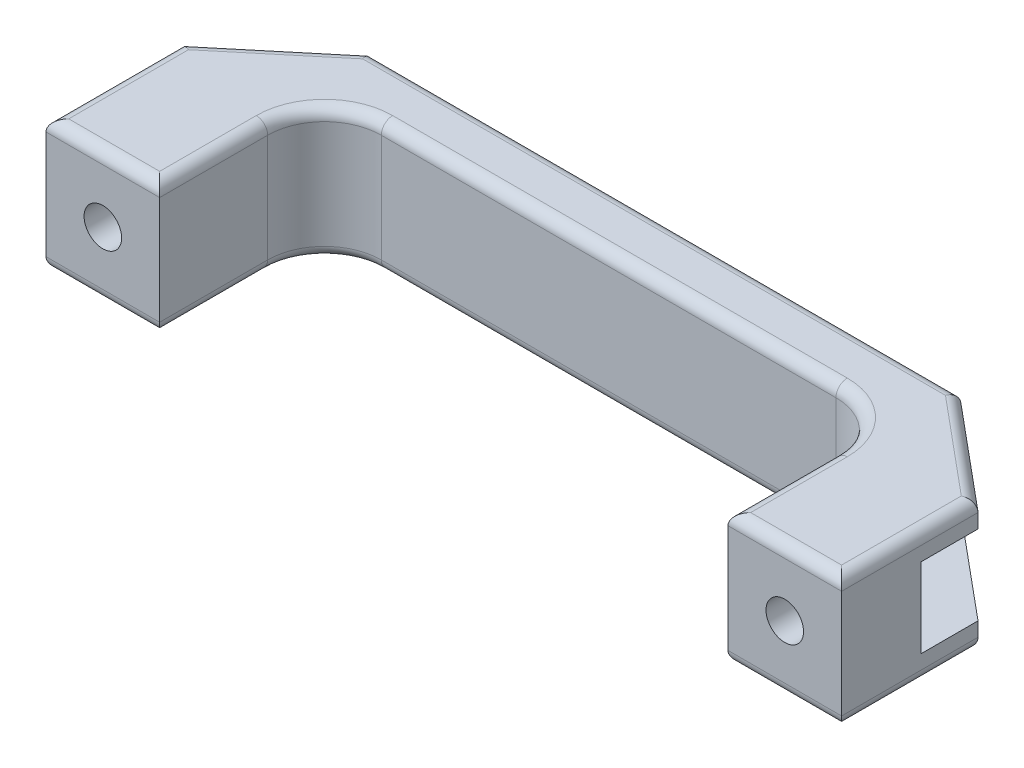
from build123d import *

# Parameters (mm, degrees)
EXTRUDE_1_DEPTH              = 23
CUT_EXTRUDE_1_DEPTH          = 84.366660003
CUT_EXTRUDE_1_DEPTH_BACK     = 84.366660003
SKETCH_2_R                   = 3.25
CUT_EXTRUDE_START            = -14
SKETCH_3_W                   = 32.603490834
SKETCH_3_H                   = 14
CUT_EXTRUDE_2_DEPTH          = 70.366660003
FILLET_1_R                   = 10
HOLE_WIZARD_M6_1_D           = 6.6
HOLE_WIZARD_M6_1_CSINK_D     = 13.44
HOLE_WIZARD_M6_1_CSINK_ANGLE = 90
FILLET_2_R                   = 2


with BuildPart() as part:
    # 草图1 → 凸台-拉伸1 (new body)
    with BuildSketch(Plane(origin=(0, 0, 0), x_dir=(1, 0, 0), z_dir=(0, 1, 0))):
        Polygon((-50, 0), (-50, 29), (50, 29), (50, 0), (70, 0), (70, 24), (52, 39), (-52, 39), (-70, 24), (-70, 0), align=None)
    extrude(amount=EXTRUDE_1_DEPTH)

    # 草图2 → 切除-拉伸1 (cut, two sides: drawn at the far end of the back side and taken through both)
    with BuildSketch(Plane.XY.offset(-CUT_EXTRUDE_1_DEPTH_BACK)):
        with Locations(Location((-60, 11.5, 0), (0, 0, 180))):
            Circle(SKETCH_2_R)
        with Locations((60, 11.5)):
            Circle(SKETCH_2_R)
    extrude(amount=CUT_EXTRUDE_1_DEPTH + CUT_EXTRUDE_1_DEPTH_BACK, mode=Mode.SUBTRACT)

    # 草图3 → 切除-拉伸2 (cut, through all)
    with BuildSketch(Plane.XY.offset(CUT_EXTRUDE_START)):
        with Locations((68.801745417, 11.5)):
            Rectangle(SKETCH_3_W, SKETCH_3_H)
        with Locations((-68.801745417, 11.5)):
            Rectangle(SKETCH_3_W, SKETCH_3_H)
    extrude(amount=-CUT_EXTRUDE_2_DEPTH, mode=Mode.SUBTRACT)

    # 圆角1
    fillet_1_edges = [part.edges().sort_by_distance(p)[0] for p in [
        (50, 11.5, -29),
        (-50, 11.5, -29),
    ]]
    fillet(fillet_1_edges, radius=FILLET_1_R)

    # M6 六角凹锥坑螺钉的锥形沉头孔1 (through all)
    with Locations(Plane(origin=(60, 11.5, -14), x_dir=(-1, 0, 0), z_dir=(0, 0, -1))):
        with Locations((0, 0), (120, 0)):
            CounterSinkHole(HOLE_WIZARD_M6_1_D / 2, HOLE_WIZARD_M6_1_CSINK_D / 2, counter_sink_angle=HOLE_WIZARD_M6_1_CSINK_ANGLE)

    # 圆角2
    fillet_2_edges = [part.edges().sort_by_distance(p)[0] for p in [
        (-70, 0, -12),
        (-61, 0, -31.5),
        (0, 0, -39),
        (61, 0, -31.5),
        (70, 0, -12),
        (60, 0, 0),
        (-50, 0, -9.5),
        (-60, 0, 0),
        (60, 23, 0),
        (70, 23, -12),
        (61, 23, -31.5),
        (0, 23, -39),
        (-61, 23, -31.5),
        (-70, 23, -12),
        (-60, 23, 0),
        (-52.5, 18.5, -26.291666667),
        (-52.5, 4.5, -26.291666667),
        (50, 0, -9.5),
        (50, 23, -9.5),
        (0, 0, -29),
        (0, 23, -29),
        (47.071067812, 0, -26.071067812),
        (47.071067812, 23, -26.071067812),
        (-47.071067812, 0, -26.071067812),
        (-50, 23, -9.5),
        (-47.071067812, 23, -26.071067812),
    ]]
    fillet(fillet_2_edges, radius=FILLET_2_R)


solid = part.part
